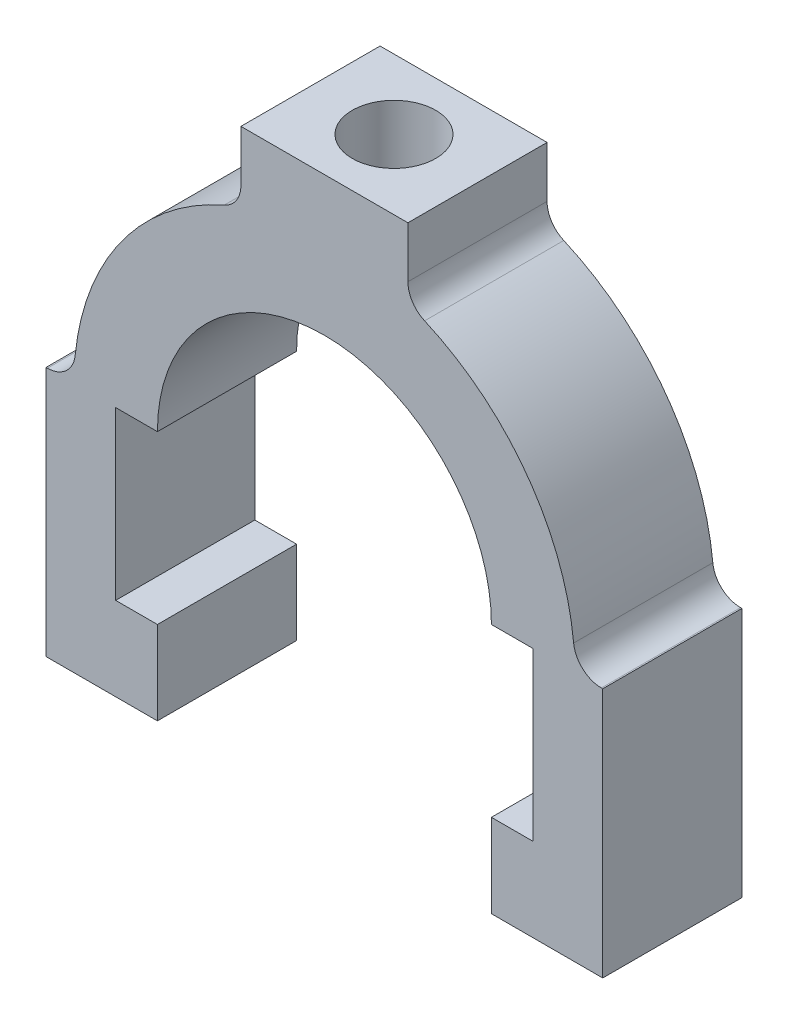
from build123d import *

# Parameters (mm, degrees)
BOSS_EXTRUDE3_DEPTH = 10
FILLET1_R           = 4
FILLET2_R           = 4
FILLET3_R           = 4
SKETCH3_R           = 6
CUT_EXTRUDE2_DEPTH  = 114.578166916


with BuildPart() as part:
    # Sketch1 → Boss-Extrude3 (new, symmetric)
    with BuildSketch(Plane.XY):
        with BuildLine():
            Line((-10, 36), (-4, 36))
            ThreePointArc((-4, 36), (-10.606123087, 56.784609691), (-28, 69.941125497))
            ThreePointArc((-28, 69.941125497), (-40, 72), (-52, 69.941125497))
            ThreePointArc((-52, 69.941125497), (-69.393876913, 56.784609691), (-76, 36))
            Line((-76, 36), (-70, 36))
            Line((-70, 36), (-64, 36))
            ThreePointArc((-64, 36), (-40, 60), (-16, 36))
            Line((-16, 36), (-10, 36))
        make_face()
        Polygon((-80, 0), (-80, 36), (-70, 36), (-70, 12), (-64, 12), (-64, 0), align=None)
        with BuildLine():
            ThreePointArc((-52, 69.941125497), (-40, 72), (-28, 69.941125497))
            Line((-28, 69.941125497), (-28, 80))
            Line((-28, 80), (-52, 80))
            Line((-52, 80), (-52, 69.941125497))
        make_face()
        Polygon((-10, 36), (0, 36), (0, 0), (-16, 0), (-16, 12), (-10, 12), align=None)
    extrude(amount=BOSS_EXTRUDE3_DEPTH, both=True)

    # Fillet1
    fillet1_edges = [part.edges().sort_by_distance(p)[0] for p in [
        (-28, 69.941125497, 0),
    ]]
    fillet(fillet1_edges, radius=FILLET1_R)

    # Fillet2
    fillet2_edges = [part.edges().sort_by_distance(p)[0] for p in [
        (-4, 36, 0),
    ]]
    fillet(fillet2_edges, radius=FILLET2_R)

    # Fillet3
    fillet3_edges = [part.edges().sort_by_distance(p)[0] for p in [
        (-76, 36, 0),
        (-52, 69.941125497, 0),
    ]]
    fillet(fillet3_edges, radius=FILLET3_R)

    # Sketch3 → Cut-Extrude2 (cut, through all)
    with BuildSketch(Plane(origin=(0, 80, 0), x_dir=(1, 0, 0), z_dir=(0, 1, 0))):
        with Locations(Location((-40, 0, 0), (0, 0, 270))):
            Circle(SKETCH3_R)
    extrude(amount=-CUT_EXTRUDE2_DEPTH, mode=Mode.SUBTRACT)


solid = part.part
